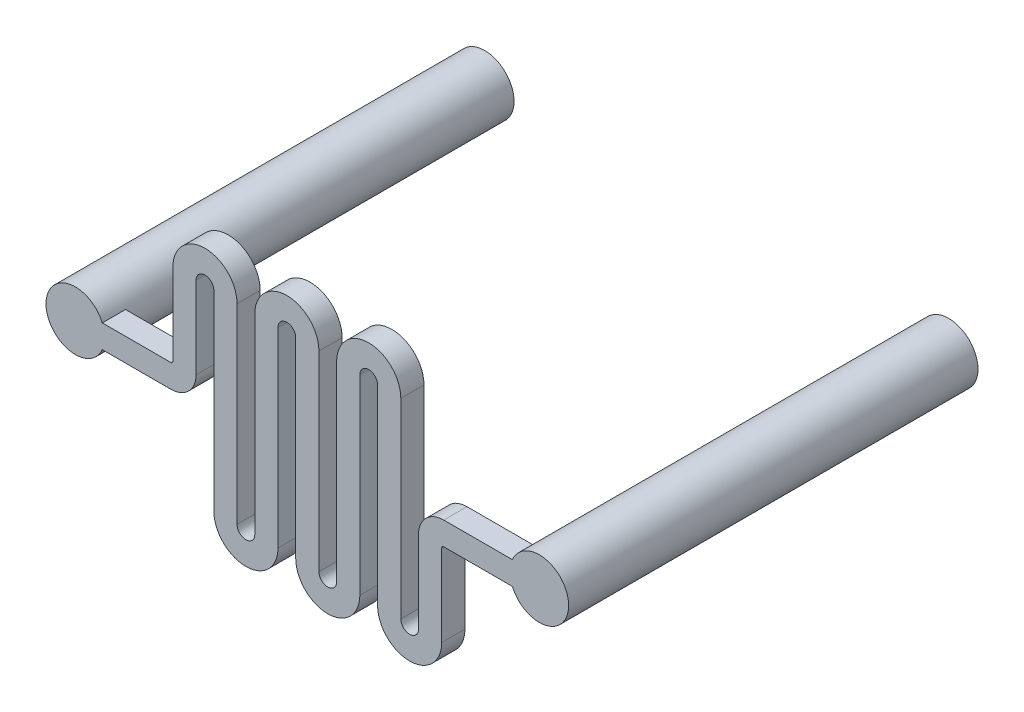
from build123d import *

# Parameters (mm, degrees)
BOSS_EXTRUDE1_DEPTH = 1.7
SKETCH3_W           = 2.15
SKETCH3_H           = 30
SKETCH4_W           = 2.15
SKETCH4_H           = 30
SKETCH5_R           = 1.5
CUT_EXTRUDE1_DEPTH  = 28


with BuildPart() as part:
    # Sketch2 → Boss-Extrude1 (new body)
    with BuildSketch(Plane.XY):
        with BuildLine():
            Line((-20.5, -0.85), (-13.5, -0.85))
            ThreePointArc((-13.5, -0.85), (-12.191852455, -0.308147545), (-11.65, 1))
            Line((-11.65, 1), (-11.65, 7))
            ThreePointArc((-11.65, 7), (-11, 7.65), (-10.35, 7))
            Line((-10.35, 7), (-10.35, 0))
            Line((-10.35, 0), (-10.35, -7))
            ThreePointArc((-10.35, -7), (-8, -9.35), (-5.65, -7))
            Line((-5.65, -7), (-5.65, 0))
            Line((-5.65, 0), (-5.65, 7))
            ThreePointArc((-5.65, 7), (-5, 7.65), (-4.35, 7))
            Line((-4.35, 7), (-4.35, 0))
            Line((-4.35, 0), (-4.35, -7))
            ThreePointArc((-4.35, -7), (-2, -9.35), (0.35, -7))
            Line((0.35, -7), (0.35, 0))
            Line((0.35, 0), (0.35, 7))
            ThreePointArc((0.35, 7), (1, 7.65), (1.65, 7))
            Line((1.65, 7), (1.65, 0))
            Line((1.65, 0), (1.65, -7))
            ThreePointArc((1.65, -7), (4, -9.35), (6.35, -7))
            Line((6.35, -7), (6.35, -1))
            ThreePointArc((6.35, -1), (6.393933983, -0.893933983), (6.5, -0.85))
            Line((6.5, -0.85), (13.5, -0.85))
            ThreePointArc((13.5, -0.85), (14.35, 0), (13.5, 0.85))
            Line((13.5, 0.85), (6.5, 0.85))
            ThreePointArc((6.5, 0.85), (5.191852455, 0.308147545), (4.65, -1))
            Line((4.65, -1), (4.65, -7))
            ThreePointArc((4.65, -7), (4, -7.65), (3.35, -7))
            Line((3.35, -7), (3.35, 0))
            Line((3.35, 0), (3.35, 7))
            ThreePointArc((3.35, 7), (1, 9.35), (-1.35, 7))
            Line((-1.35, 7), (-1.35, 0))
            Line((-1.35, 0), (-1.35, -7))
            ThreePointArc((-1.35, -7), (-2, -7.65), (-2.65, -7))
            Line((-2.65, -7), (-2.65, 0))
            Line((-2.65, 0), (-2.65, 7))
            ThreePointArc((-2.65, 7), (-5, 9.35), (-7.35, 7))
            Line((-7.35, 7), (-7.35, 0))
            Line((-7.35, 0), (-7.35, -7))
            ThreePointArc((-7.35, -7), (-8, -7.65), (-8.65, -7))
            Line((-8.65, -7), (-8.65, 0))
            Line((-8.65, 0), (-8.65, 7))
            ThreePointArc((-8.65, 7), (-11, 9.35), (-13.35, 7))
            Line((-13.35, 7), (-13.35, 1))
            ThreePointArc((-13.35, 1), (-13.393933983, 0.893933983), (-13.5, 0.85))
            Line((-13.5, 0.85), (-20.5, 0.85))
            ThreePointArc((-20.5, 0.85), (-21.35, 0), (-20.5, -0.85))
        make_face()
    extrude(amount=BOSS_EXTRUDE1_DEPTH)

    # Sketch3 → Revolve1 (revolve)
    with BuildSketch(Plane(origin=(0, 0, 0), x_dir=(1, 0, 0), z_dir=(0, 1, 0)), mode=Mode.PRIVATE) as revolve1_sk:
        with Locations((-21.575, 13.3)):
            Rectangle(SKETCH3_W, SKETCH3_H)
    revolve(revolve1_sk.sketch.rotate(Axis((-20.5, 0, 1.7), (0, 0, -1)), 180), axis=Axis((-20.5, 0, 1.7), (0, 0, -1)))

    # Sketch4 → Revolve2 (revolve)
    with BuildSketch(Plane(origin=(0, 0, 0), x_dir=(1, 0, 0), z_dir=(0, 1, 0))):
        with Locations((14.575, 13.3)):
            Rectangle(SKETCH4_W, SKETCH4_H)
    revolve(axis=Axis((13.5, 0, 1.7), (0, 0, -1)))

    # Sketch5 → Cut-Extrude1 (cut)
    with BuildSketch(Plane(origin=(0, 0, -28.3), x_dir=(-1, 0, 0), z_dir=(0, 0, -1))):
        with Locations((-13.5, 0)):
            Circle(SKETCH5_R)
        with Locations((20.5, 0)):
            Circle(SKETCH5_R)
    extrude(amount=-CUT_EXTRUDE1_DEPTH, mode=Mode.SUBTRACT)


solid = part.part
